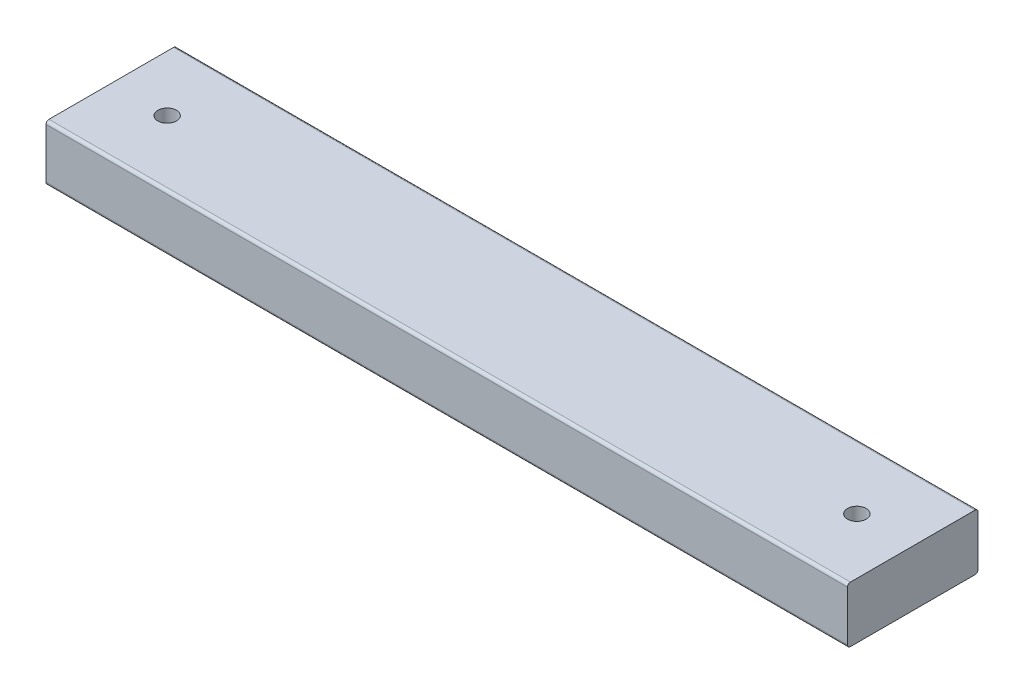
from build123d import *

# Parameters (mm, degrees)
SKETCH1_W           = 88.9
SKETCH1_H           = 38.1
BOSS_EXTRUDE1_DEPTH = 546.1
FILLET1_R           = 2
SKETCH3_R           = 6.35
CUT_EXTRUDE2_DEPTH  = 550.229116581


with BuildPart() as part:
    # Sketch1 → Boss-Extrude1 (new body)
    with BuildSketch(Plane(origin=(0, 0, 0), x_dir=(0, 0, -1), z_dir=(1, 0, 0))):
        Rectangle(SKETCH1_W, SKETCH1_H)
    extrude(amount=BOSS_EXTRUDE1_DEPTH)

    # Fillet1
    fillet1_edges = [part.edges().sort_by_distance(p)[0] for p in [
        (273.05, -19.05, -44.45),
        (273.05, -19.05, 44.45),
        (273.05, 19.05, 44.45),
        (273.05, 19.05, -44.45),
    ]]
    fillet(fillet1_edges, radius=FILLET1_R)

    # Sketch3 → Cut-Extrude2 (cut, through all)
    with BuildSketch(Plane(origin=(0, 19.05, 0), x_dir=(1, 0, 0), z_dir=(0, 1, 0))):
        with Locations(Location((508, 0, 0), (0, 0, 270))):
            Circle(SKETCH3_R)
    cut_extrude2 = extrude(amount=-CUT_EXTRUDE2_DEPTH, mode=Mode.SUBTRACT)

    # Mirror1: Cut-Extrude2 across plane
    add(cut_extrude2.mirror(Plane(origin=(273.05, 0, 0), x_dir=(0, 0, 1), z_dir=(1, 0, 0))), mode=Mode.SUBTRACT)


solid = part.part
